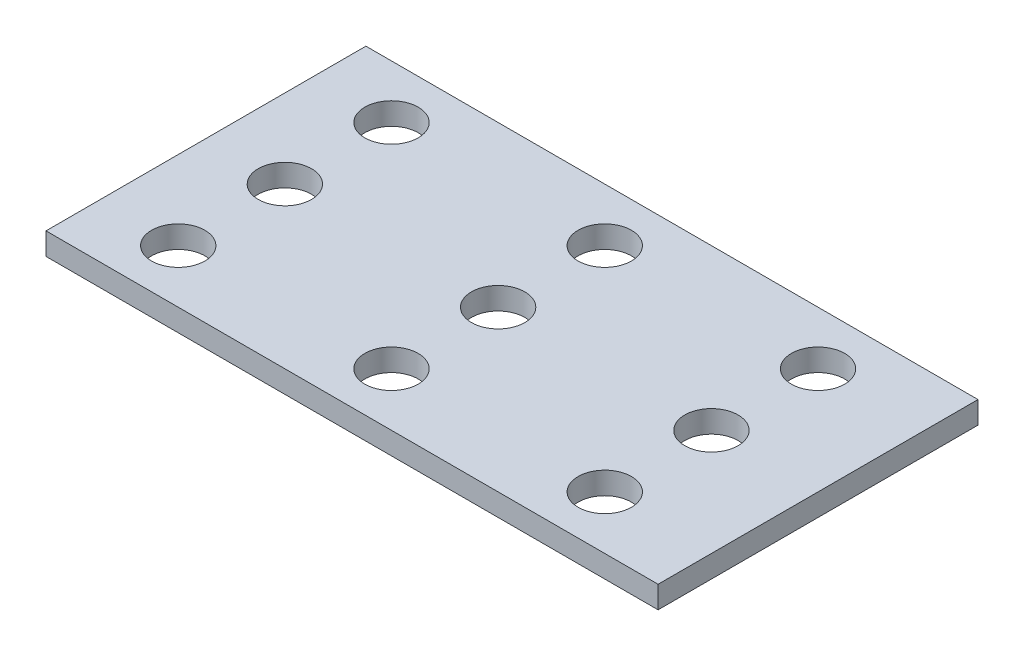
from build123d import *

# Parameters (mm, degrees)
SKETCH2_W           = 57.4
SKETCH2_H           = 30
SKETCH2_R           = 2.5
BOSS_EXTRUDE1_DEPTH = 1.04


with BuildPart() as part:
    # Sketch2 → Boss-Extrude1 (new, symmetric)
    with BuildSketch(Plane(origin=(0, 0, 0), x_dir=(1, 0, 0), z_dir=(0, 1, 0))):
        with Locations((-28.7, 15)):
            Rectangle(SKETCH2_W, SKETCH2_H)
        with Locations(Location((-50, 25, 0), (0, 0, 270))):
            Circle(SKETCH2_R, mode=Mode.SUBTRACT)
        with Locations(Location((-50, 15, 0), (0, 0, 270))):
            Circle(SKETCH2_R, mode=Mode.SUBTRACT)
        with Locations(Location((-50, 5, 0), (0, 0, 270))):
            Circle(SKETCH2_R, mode=Mode.SUBTRACT)
        with Locations(Location((-30, 5, 0), (0, 0, 270))):
            Circle(SKETCH2_R, mode=Mode.SUBTRACT)
        with Locations(Location((-30, 15, 0), (0, 0, 270))):
            Circle(SKETCH2_R, mode=Mode.SUBTRACT)
        with Locations(Location((-30, 25, 0), (0, 0, 270))):
            Circle(SKETCH2_R, mode=Mode.SUBTRACT)
        with Locations(Location((-10, 5, 0), (0, 0, 270))):
            Circle(SKETCH2_R, mode=Mode.SUBTRACT)
        with Locations(Location((-10, 15, 0), (0, 0, 270))):
            Circle(SKETCH2_R, mode=Mode.SUBTRACT)
        with Locations(Location((-10, 25, 0), (0, 0, 270))):
            Circle(SKETCH2_R, mode=Mode.SUBTRACT)
    extrude(amount=BOSS_EXTRUDE1_DEPTH, both=True)


solid = part.part
